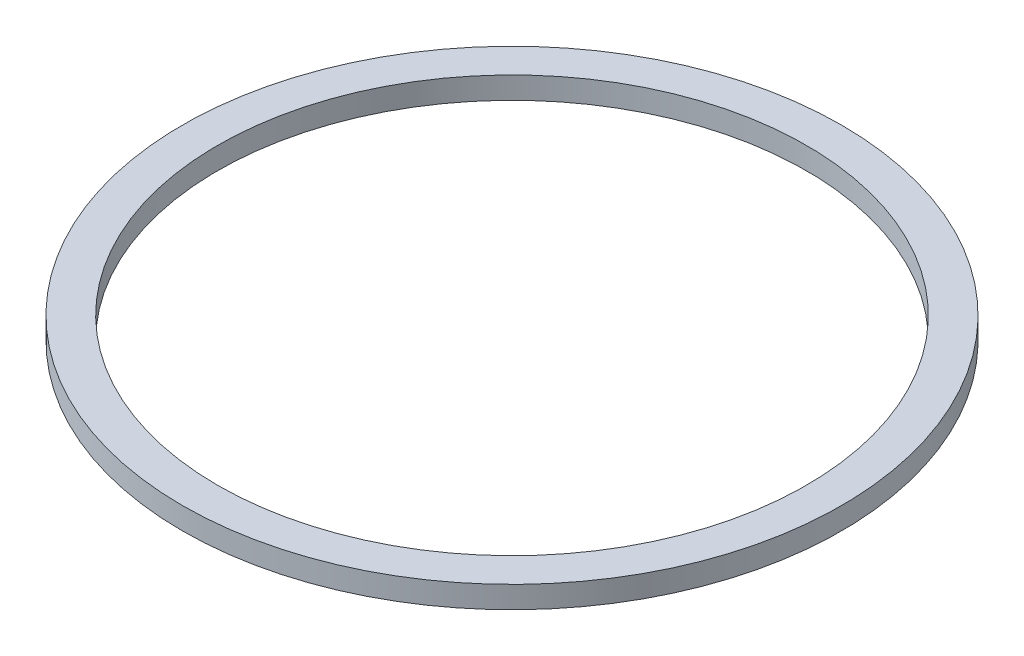
from build123d import *

# Parameters (mm, degrees)
SKETCH1_R           = 38.1
SKETCH1_R_2         = 34.036
BOSS_EXTRUDE1_DEPTH = 2.54


with BuildPart() as part:
    # Sketch1 → Boss-Extrude1 (new body)
    with BuildSketch(Plane(origin=(0, 0, 0), x_dir=(1, 0, 0), z_dir=(0, 1, 0))):
        with Locations(Location((0, 0, 0), (0, 0, 270))):
            Circle(SKETCH1_R)
        with Locations(Location((0, 0, 0), (0, 0, 270))):
            Circle(SKETCH1_R_2, mode=Mode.SUBTRACT)
    extrude(amount=BOSS_EXTRUDE1_DEPTH)


solid = part.part
